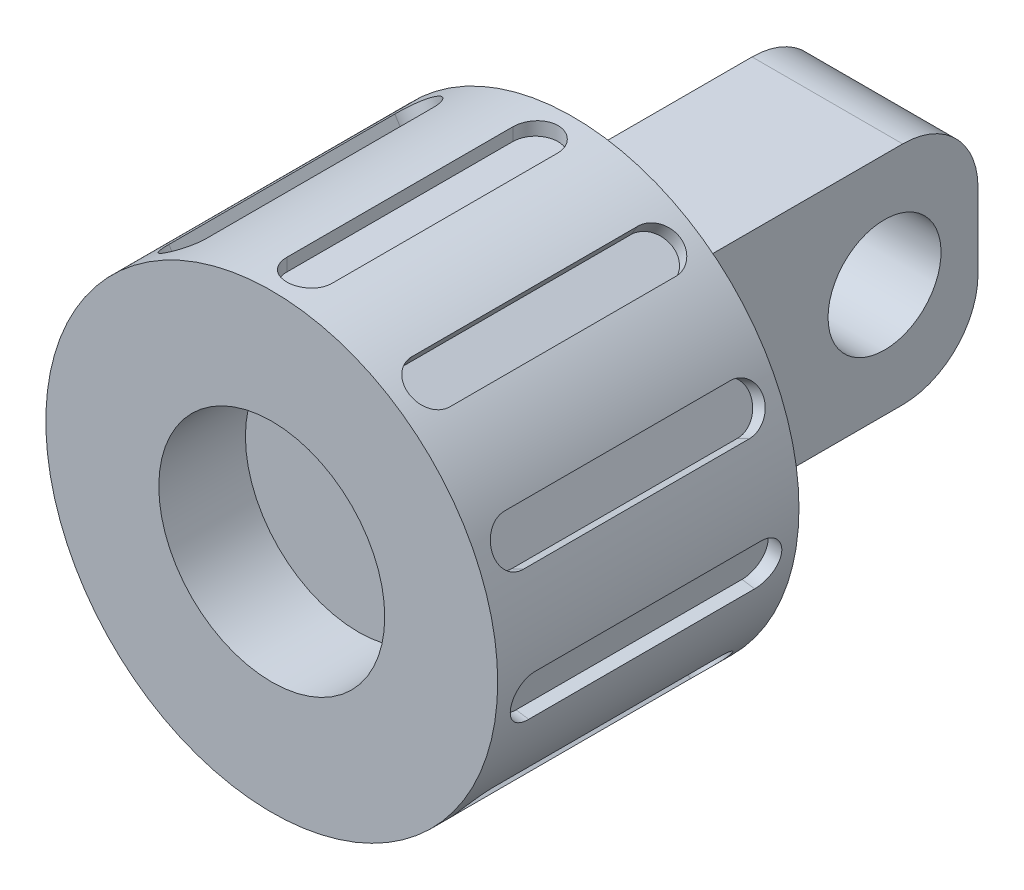
from build123d import *

# Parameters (mm, degrees)
SKETCH1_R           = 30
BOSS_EXTRUDE1_DEPTH = 40
SKETCH2_R           = 15
CUT_EXTRUDE1_DEPTH  = 11.5
SKETCH3_W           = 20
SKETCH3_H           = 30
BOSS_EXTRUDE2_DEPTH = 43.77
FILLET1_R           = 10
SKETCH4_R           = 7.5
CUT_EXTRUDE2_DEPTH  = 43.77
CUT_EXTRUDE3_DEPTH  = 1.85
CIRPATTERN1_COUNT   = 11


with BuildPart() as part:
    # Sketch1 → Boss-Extrude1 (new body)
    with BuildSketch(Plane.XY):
        Circle(SKETCH1_R)
    extrude(amount=-BOSS_EXTRUDE1_DEPTH)

    # Sketch2 → Cut-Extrude1 (cut)
    with BuildSketch(Plane.XY):
        Circle(SKETCH2_R)
    extrude(amount=-CUT_EXTRUDE1_DEPTH, mode=Mode.SUBTRACT)

    # Sketch3 → Boss-Extrude2 (add)
    with BuildSketch(Plane(origin=(0, 0, -40), x_dir=(-1, 0, 0), z_dir=(0, 0, -1))):
        Rectangle(SKETCH3_W, SKETCH3_H)
    extrude(amount=BOSS_EXTRUDE2_DEPTH)

    # Fillet1
    fillet1_edges = [part.edges().sort_by_distance(p)[0] for p in [
        (0, -15, -83.77),
        (0, 15, -83.77),
    ]]
    fillet(fillet1_edges, radius=FILLET1_R)

    # Sketch4 → Cut-Extrude2 (cut)
    with BuildSketch(Plane.ZY.offset(10)):
        with Locations(Location((-71.36, 0, 0), (0, 0, 270))):
            Circle(SKETCH4_R)
    extrude(amount=-CUT_EXTRUDE2_DEPTH, mode=Mode.SUBTRACT)

    # Sketch5 → Cut-Extrude3 (cut)
    with BuildSketch(Plane(origin=(0, 30, 0), x_dir=(1, 0, 0), z_dir=(0, 1, 0))):
        with BuildLine():
            Line((3, 35), (3, 5))
            ThreePointArc((3, 5), (0, 2), (-3, 5))
            Line((-3, 5), (-3, 35))
            ThreePointArc((-3, 35), (0, 38), (3, 35))
        make_face()
    cut_extrude3 = extrude(amount=-CUT_EXTRUDE3_DEPTH, mode=Mode.SUBTRACT)

    # CirPattern1: Cut-Extrude3 ×11 about axis
    cirpattern1_axis = Axis((0, 0, 0), (0, 0, 1))
    for i in range(1, CIRPATTERN1_COUNT):
        add(cut_extrude3.rotate(cirpattern1_axis, i * 360 / CIRPATTERN1_COUNT), mode=Mode.SUBTRACT)


solid = part.part
